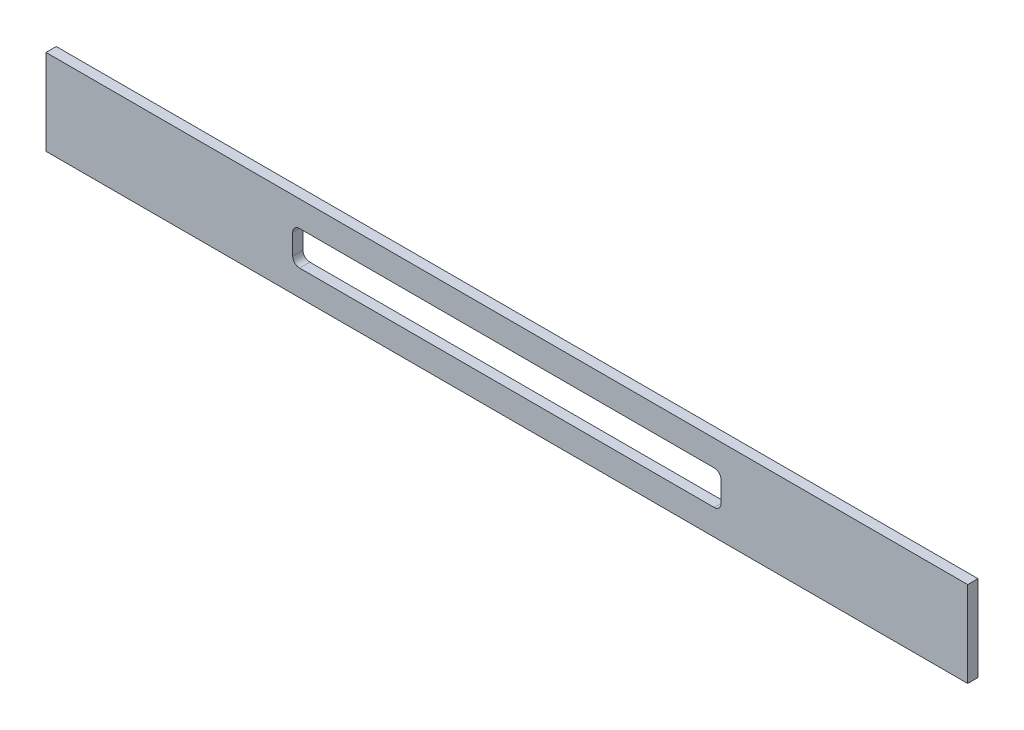
from build123d import *

# Parameters (mm, degrees)
SKETCH_1_W      = 538
SKETCH_1_H      = 50
EXTRUDE_1_DEPTH = 6


with BuildPart() as part:
    # Эскиз1 → Бобышка-Вытянуть1 (new body)
    with BuildSketch(Plane.XY):
        with Locations((95.16967509, -17.799165817)):
            Rectangle(SKETCH_1_W, SKETCH_1_H)
        with BuildLine():
            Line((-25.83032491, -7.799165817), (216.16967509, -7.799165817))
            ThreePointArc((216.16967509, -7.799165817), (218.998102215, -8.970738692), (220.16967509, -11.799165817))
            Line((220.16967509, -11.799165817), (220.16967509, -23.799165817))
            ThreePointArc((220.16967509, -23.799165817), (218.998102215, -26.627592942), (216.16967509, -27.799165817))
            Line((216.16967509, -27.799165817), (-25.83032491, -27.799165817))
            ThreePointArc((-25.83032491, -27.799165817), (-28.658752034, -26.627592942), (-29.83032491, -23.799165817))
            Line((-29.83032491, -23.799165817), (-29.83032491, -11.799165817))
            ThreePointArc((-29.83032491, -11.799165817), (-28.658752034, -8.970738692), (-25.83032491, -7.799165817))
        make_face(mode=Mode.SUBTRACT)
    extrude(amount=EXTRUDE_1_DEPTH)


solid = part.part
